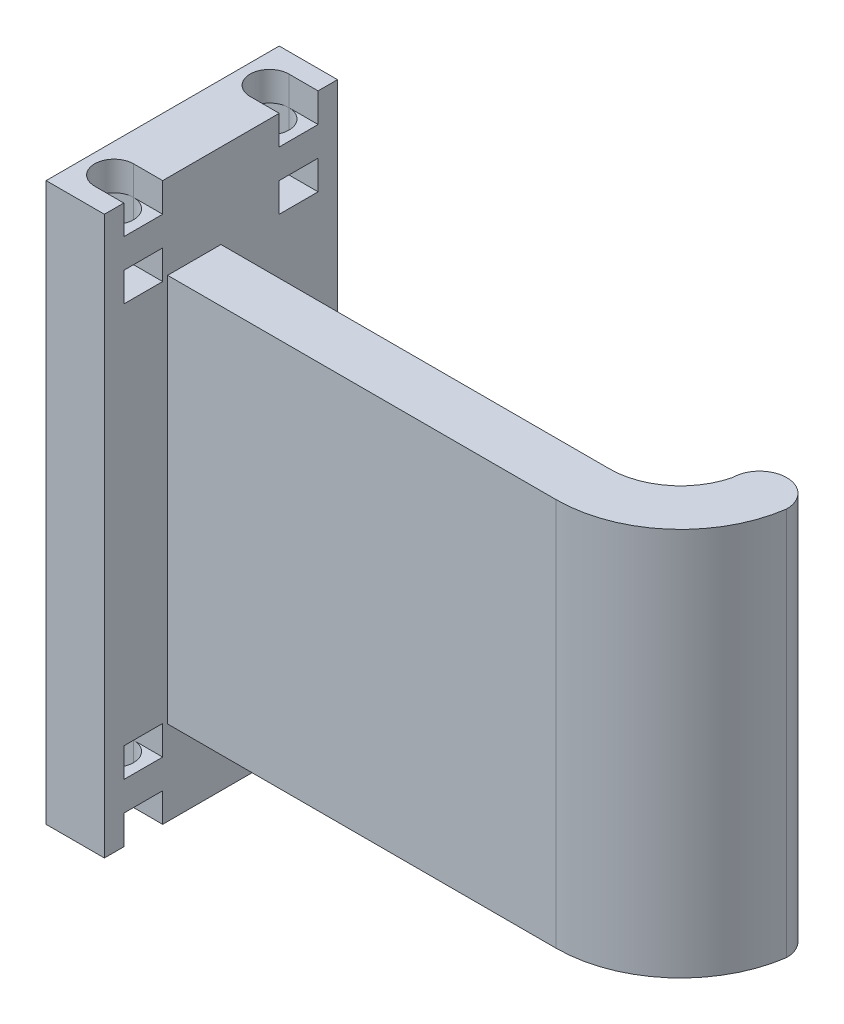
from build123d import *

# Parameters (mm, degrees)
SKETCH1_W                = 3
SKETCH1_H                = 12
BOSS_EXTRUDE1_DEPTH      = 3
ESQUISSE1_W              = 3
ESQUISSE1_H              = 12
BOSS_EXTRU_1_DEPTH       = 25.7
ESQUISSE2_R              = 1
ENL_V_MAT_EXTRU_1_DEPTH  = 4.5
ENL_V_START              = -4.5
ESQUISSE10_R             = 1
ENL_V_MAT_EXTRU_3_DEPTH  = 4.5
ESQUISSE13_W             = 2
ESQUISSE13_H             = 1.5
ENL_V_MAT_EXTRU_5_DEPTH  = 5
ESQUISSE14_W             = 2
ESQUISSE14_H             = 1.5
ENL_V_MAT_EXTRU_6_DEPTH  = 5
BOSS_EXTRUDE2_DEPTH      = 10
BOSS_EXTRUDE2_DEPTH_BACK = 10
SKETCH2_W                = 20
SKETCH2_H                = 2.745941069


with BuildPart() as part:
    # Sketch1 → Boss-Extrude1 (new body)
    with BuildSketch(Plane(origin=(0, 0, 0), x_dir=(1, 0, 0), z_dir=(0, 1, 0))):
        with Locations((13.5, 0)):
            Rectangle(SKETCH1_W, SKETCH1_H)
    extrude(amount=-BOSS_EXTRUDE1_DEPTH)

    # Esquisse1 → Boss.-Extru.1 (add)
    with BuildSketch(Plane(origin=(0, 0, 0), x_dir=(1, 0, 0), z_dir=(0, 1, 0))):
        with Locations((13.5, 0)):
            Rectangle(ESQUISSE1_W, ESQUISSE1_H)
    extrude(amount=BOSS_EXTRU_1_DEPTH)

    # Esquisse2 → Enlèv. mat.-Extru.1 (cut)
    with BuildSketch(Plane(origin=(0, 25.7, 0), x_dir=(1, 0, 0), z_dir=(0, 1, 0))):
        with Locations(Location((13.5, 4, 0), (0, 0, 270))):
            Circle(ESQUISSE2_R)
        with Locations(Location((13.5, -4, 0), (0, 0, 270))):
            Circle(ESQUISSE2_R)
    extrude(amount=-ENL_V_MAT_EXTRU_1_DEPTH, mode=Mode.SUBTRACT)

    # Esquisse10 → Enlèv. mat.-Extru.3 (cut)
    with BuildSketch(Plane.XZ.offset(3).offset(ENL_V_START)):
        with Locations(Location((13.5, -4, 0), (0, 0, 90))):
            Circle(ESQUISSE10_R)
        with Locations(Location((13.5, 4, 0), (0, 0, 90))):
            Circle(ESQUISSE10_R)
    extrude(amount=ENL_V_MAT_EXTRU_3_DEPTH, mode=Mode.SUBTRACT)

    # Esquisse13 → Enlèv. mat.-Extru.5 (cut)
    with BuildSketch(Plane.ZY.offset(-13.5)):
        with Locations((4, -2.25)):
            Rectangle(ESQUISSE13_W, ESQUISSE13_H)
        with Locations((4, 0.75)):
            Rectangle(ESQUISSE13_W, ESQUISSE13_H)
        with Locations((-4, 0.75)):
            Rectangle(ESQUISSE13_W, ESQUISSE13_H)
        with Locations((-4, -2.25)):
            Rectangle(ESQUISSE13_W, ESQUISSE13_H)
        with Locations((-4, 24.95)):
            Rectangle(ESQUISSE13_W, ESQUISSE13_H)
        with Locations((-4, 21.95)):
            Rectangle(ESQUISSE13_W, ESQUISSE13_H)
        with Locations((4, 21.95)):
            Rectangle(ESQUISSE13_W, ESQUISSE13_H)
        with Locations((4, 24.95)):
            Rectangle(ESQUISSE13_W, ESQUISSE13_H)
    extrude(amount=-ENL_V_MAT_EXTRU_5_DEPTH, mode=Mode.SUBTRACT)

    # Esquisse14 → Enlèv. mat.-Extru.6 (cut)
    with BuildSketch(Plane.ZY.offset(-13.5)):
        with Locations((-4, -0.75)):
            Rectangle(ESQUISSE14_W, ESQUISSE14_H)
        with Locations((4, -0.75)):
            Rectangle(ESQUISSE14_W, ESQUISSE14_H)
        with Locations((4, 23.45)):
            Rectangle(ESQUISSE14_W, ESQUISSE14_H)
        with Locations((-4, 23.45)):
            Rectangle(ESQUISSE14_W, ESQUISSE14_H)
    extrude(amount=ENL_V_MAT_EXTRU_6_DEPTH, mode=Mode.SUBTRACT)

    # Sketch2 → Boss-Extrude2 (add, two sides: drawn at the far end of the back side and taken through both)
    with BuildSketch(Plane(origin=(0, 11.35, 0), x_dir=(1, 0, 0), z_dir=(0, 1, 0)).offset(-BOSS_EXTRUDE2_DEPTH_BACK)):
        with Locations((25, -1.372970535)):
            Rectangle(SKETCH2_W, SKETCH2_H)
        with BuildLine():
            ThreePointArc((35, -2.745941069), (39.206766833, -1.17258084), (41.348589647, 2.775196335))
            Line((41.348589647, 2.775196335), (38.555074141, 2.775196335))
            ThreePointArc((38.555074141, 2.775196335), (37.255009249, 0.775948112), (35, 0))
            Line((35, 0), (35, -2.745941069))
        make_face()
        with BuildLine():
            Line((41.348589647, 2.775196335), (38.555074141, 2.775196335))
            ThreePointArc((38.555074141, 2.775196335), (39.951831894, 4.171954088), (41.348589647, 2.775196335))
        make_face()
    extrude(amount=BOSS_EXTRUDE2_DEPTH + BOSS_EXTRUDE2_DEPTH_BACK)


solid = part.part
